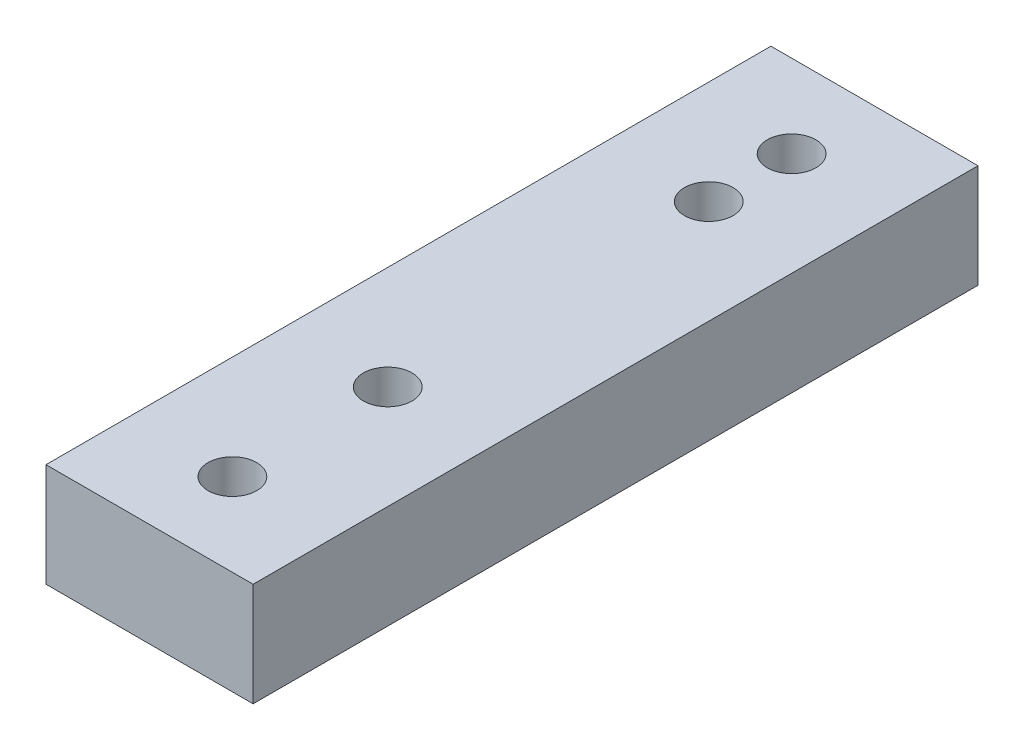
from build123d import *

# Parameters (mm, degrees)
SKETCH1_W           = 20
SKETCH1_H           = 70
SKETCH1_R           = 2.35
BOSS_EXTRUDE1_DEPTH = 10


with BuildPart() as part:
    # Sketch1 → Boss-Extrude1 (new body)
    with BuildSketch(Plane(origin=(0, 0, 0), x_dir=(1, 0, 0), z_dir=(0, 1, 0))):
        with Locations((10, 35)):
            Rectangle(SKETCH1_W, SKETCH1_H)
        with Locations(Location((10, 62, 0), (0, 0, 270))):
            Circle(SKETCH1_R, mode=Mode.SUBTRACT)
        with Locations(Location((10, 54, 0), (0, 0, 270))):
            Circle(SKETCH1_R, mode=Mode.SUBTRACT)
        with Locations(Location((10, 23, 0), (0, 0, 270))):
            Circle(SKETCH1_R, mode=Mode.SUBTRACT)
        with Locations(Location((10, 8, 0), (0, 0, 270))):
            Circle(SKETCH1_R, mode=Mode.SUBTRACT)
    extrude(amount=BOSS_EXTRUDE1_DEPTH)


solid = part.part
